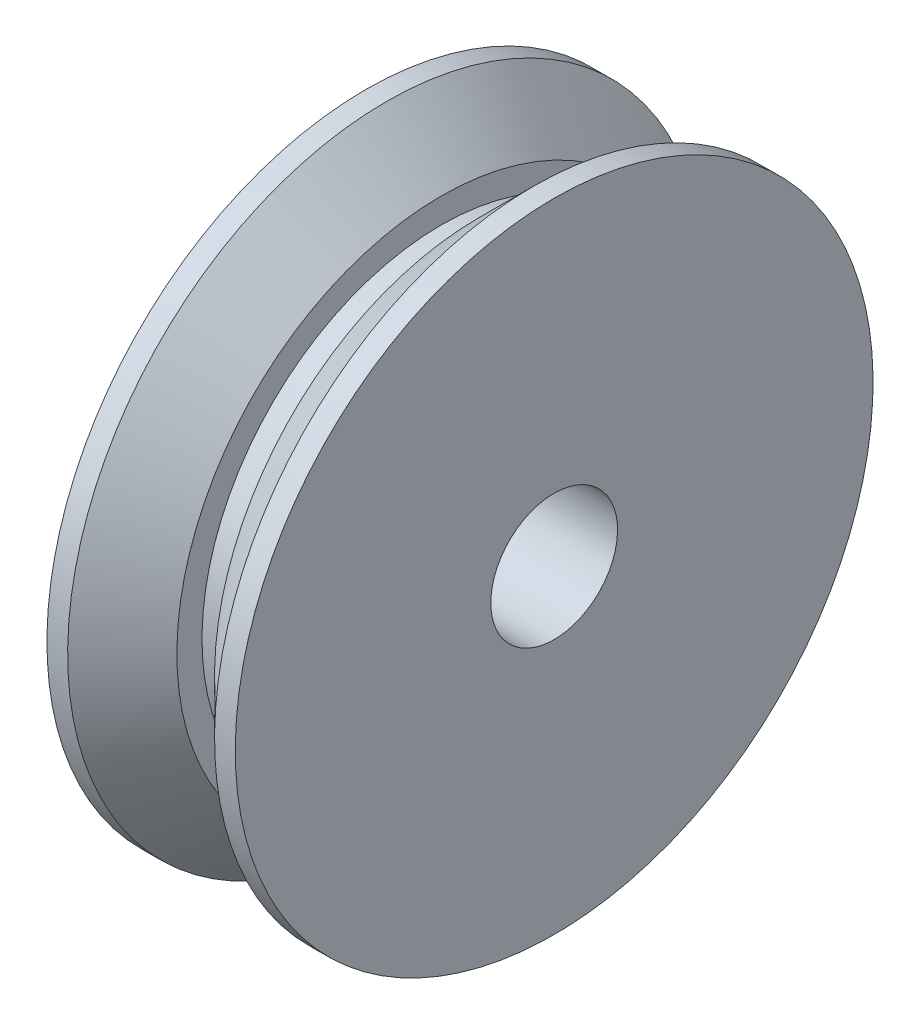
from build123d import *


with BuildPart() as part:
    # Esboço1 → Revolução1 (revolve)
    with BuildSketch(Plane.XY, mode=Mode.PRIVATE) as revolu_o1_sk:
        Polygon((5.85, -25.4), (1.5, -21.05), (1.5, -19.05), (-1.5, -19.05), (-1.5, -21.05), (-5.85, -25.4), (-7.5, -25.4), (-7.5, -5.05), (7.5, -5.05), (7.5, -25.4), align=None)
    revolve(revolu_o1_sk.sketch.rotate(Axis((0, 0, 0), (-1, 0, 0)), 180), axis=Axis((0, 0, 0), (-1, 0, 0)))


solid = part.part
